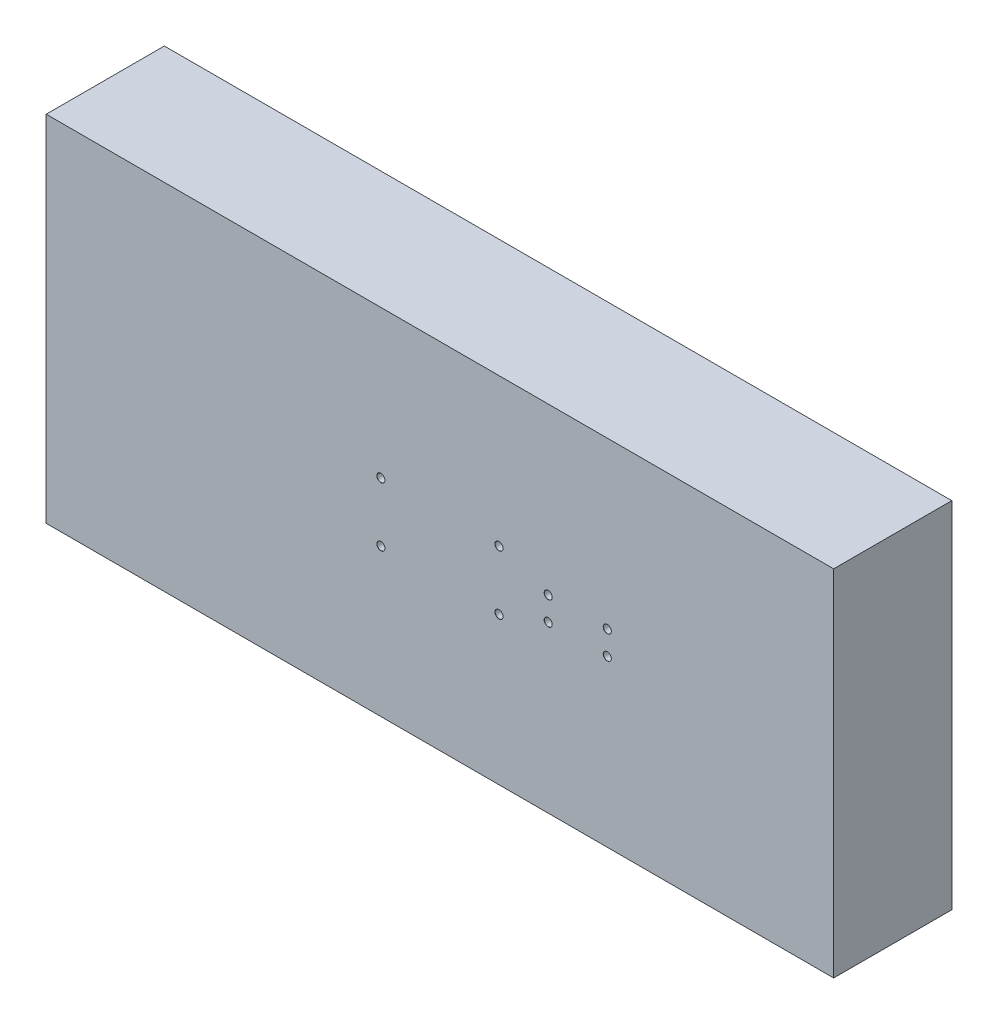
from build123d import *

# Parameters (mm, degrees)
BOSS_EXTRUDE2_DEPTH             = 100
BOSS_EXTRUDE2_DEPTH_BACK        = 100
SKETCH1_W                       = 90
SKETCH1_H                       = 30
F_2_0MM_DOWEL_HOLE1_D           = 2
F_2_0MM_DOWEL_HOLE1_DEPTH       = 10
F_2_0MM_DOWEL_HOLE1_CSINK_D     = 2.05
F_2_0MM_DOWEL_HOLE1_CSINK_ANGLE = 90
F_2_0MM_DOWEL_HOLE1_TIP         = 0.600860619
F_2_0MM_DOWEL_HOLE2_D           = 2
F_2_0MM_DOWEL_HOLE2_DEPTH       = 10
F_2_0MM_DOWEL_HOLE2_CSINK_D     = 2.05
F_2_0MM_DOWEL_HOLE2_CSINK_ANGLE = 90
F_2_0MM_DOWEL_HOLE2_TIP         = 0.600860619


with BuildPart() as part:
    # Sketch1 → Boss-Extrude2 (new, two sides: drawn at the far end of the back side and taken through both)
    with BuildSketch(Plane.YZ.offset(-BOSS_EXTRUDE2_DEPTH_BACK)):
        with Locations((-45, 15)):
            Rectangle(SKETCH1_W, SKETCH1_H)
    extrude(amount=BOSS_EXTRUDE2_DEPTH + BOSS_EXTRUDE2_DEPTH_BACK)

    # Ø2.0mm Dowel Hole1
    with Locations(Plane.XY.offset(30)):
        with Locations((15, -52.5), (-15, -37.5), (-15, -52.5), (15, -37.5)):
            CounterSinkHole(F_2_0MM_DOWEL_HOLE1_D / 2, F_2_0MM_DOWEL_HOLE1_CSINK_D / 2, depth=F_2_0MM_DOWEL_HOLE1_DEPTH, counter_sink_angle=F_2_0MM_DOWEL_HOLE1_CSINK_ANGLE)
            with Locations((0, 0, -(F_2_0MM_DOWEL_HOLE1_DEPTH + F_2_0MM_DOWEL_HOLE1_TIP / 2))):  # 118° drill point
                Cone(0, F_2_0MM_DOWEL_HOLE1_D / 2, F_2_0MM_DOWEL_HOLE1_TIP, mode=Mode.SUBTRACT)

    # Ø2.0mm Dowel Hole2
    with Locations(Plane.XY.offset(30)):
        with Locations((42.5, -42), (27.5, -42), (27.5, -48), (42.5, -48)):
            CounterSinkHole(F_2_0MM_DOWEL_HOLE2_D / 2, F_2_0MM_DOWEL_HOLE2_CSINK_D / 2, depth=F_2_0MM_DOWEL_HOLE2_DEPTH, counter_sink_angle=F_2_0MM_DOWEL_HOLE2_CSINK_ANGLE)
            with Locations((0, 0, -(F_2_0MM_DOWEL_HOLE2_DEPTH + F_2_0MM_DOWEL_HOLE2_TIP / 2))):  # 118° drill point
                Cone(0, F_2_0MM_DOWEL_HOLE2_D / 2, F_2_0MM_DOWEL_HOLE2_TIP, mode=Mode.SUBTRACT)


solid = part.part
